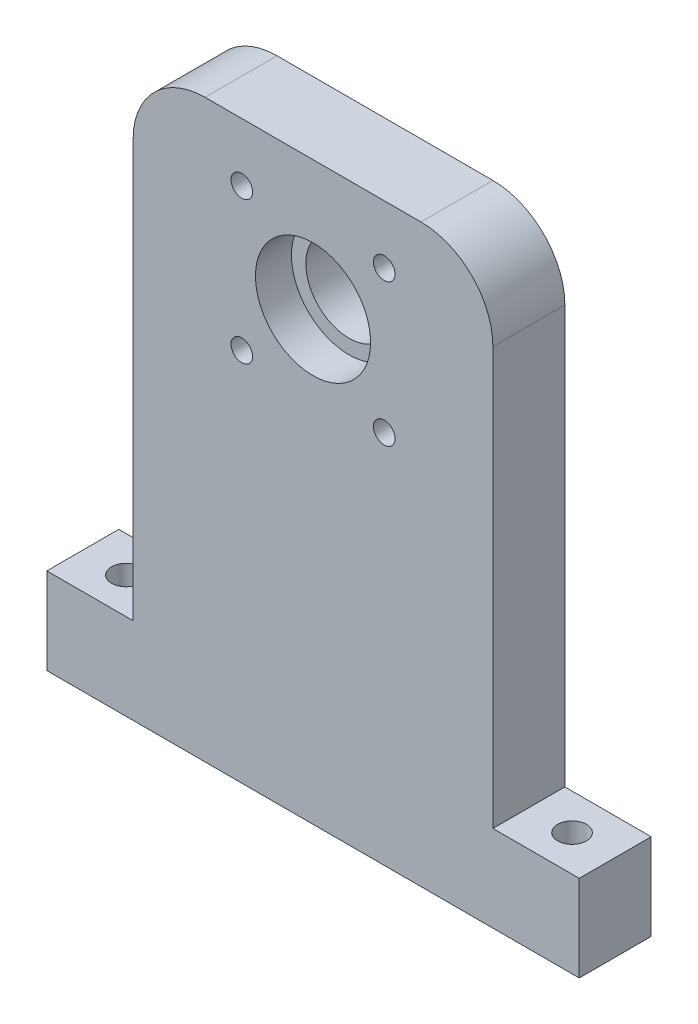
from build123d import *

# Parameters (mm, degrees)
BOSS_EXTRUDE1_DEPTH = 10
SKETCH2_R           = 8
CUT_EXTRUDE1_DEPTH  = 5
FILLET1_R           = 10
SKETCH4_R           = 2
CUT_EXTRUDE3_DEPTH  = 21
SKETCH5_R           = 2
CUT_EXTRUDE4_DEPTH  = 25
SKETCH6_R           = 1.5
CUT_EXTRUDE5_DEPTH  = 10
CIRPATTERN1_COUNT   = 4
SKETCH8_R           = 6
CUT_EXTRUDE8_DEPTH  = 10


with BuildPart() as part:
    # Sketch1 → Boss-Extrude1 (new body)
    with BuildSketch(Plane.XY):
        Polygon((-37.625, -24), (36.375, -24), (36.375, -12), (24.375, -12), (24.375, 56), (-25.625, 56), (-25.625, -12), (-37.625, -12), align=None)
    extrude(amount=BOSS_EXTRUDE1_DEPTH)

    # Sketch2 → Cut-Extrude1 (cut)
    with BuildSketch(Plane.XY.offset(10)):
        with Locations((-0.625, 38)):
            Circle(SKETCH2_R)
    extrude(amount=-CUT_EXTRUDE1_DEPTH, mode=Mode.SUBTRACT)

    # Fillet1
    fillet1_edges = [part.edges().sort_by_distance(p)[0] for p in [
        (24.375, 56, 5),
        (-25.625, 56, 5),
    ]]
    fillet(fillet1_edges, radius=FILLET1_R)

    # Sketch4 → Cut-Extrude3 (cut)
    with BuildSketch(Plane(origin=(0, -12, 0), x_dir=(1, 0, 0), z_dir=(0, 1, 0))):
        with Locations(Location((30.375, -5, 0), (0, 0, 180))):
            Circle(SKETCH4_R)
    extrude(amount=-CUT_EXTRUDE3_DEPTH, mode=Mode.SUBTRACT)

    # Sketch5 → Cut-Extrude4 (cut)
    with BuildSketch(Plane(origin=(0, -12, 0), x_dir=(1, 0, 0), z_dir=(0, 1, 0))):
        with Locations(Location((-31.625, -5, 0), (0, 0, 270))):
            Circle(SKETCH5_R)
    extrude(amount=-CUT_EXTRUDE4_DEPTH, mode=Mode.SUBTRACT)

    # Sketch6 → Cut-Extrude5 (cut)
    with BuildSketch(Plane.XY.offset(10)):
        with Locations((9.274494937, 47.899494937)):
            Circle(SKETCH6_R)
    cut_extrude5 = extrude(amount=-CUT_EXTRUDE5_DEPTH, mode=Mode.SUBTRACT)

    # CirPattern1: Cut-Extrude5 ×4 about axis
    cirpattern1_axis = Axis((-0.625, 38, 0), (0, 0, 1))
    for i in range(1, CIRPATTERN1_COUNT):
        add(cut_extrude5.rotate(cirpattern1_axis, i * 360 / CIRPATTERN1_COUNT), mode=Mode.SUBTRACT)

    # Sketch8 → Cut-Extrude8 (cut)
    with BuildSketch(Plane.XY.offset(10)):
        with Locations((-0.625, 38)):
            Circle(SKETCH8_R)
    extrude(amount=-CUT_EXTRUDE8_DEPTH, mode=Mode.SUBTRACT)


solid = part.part
